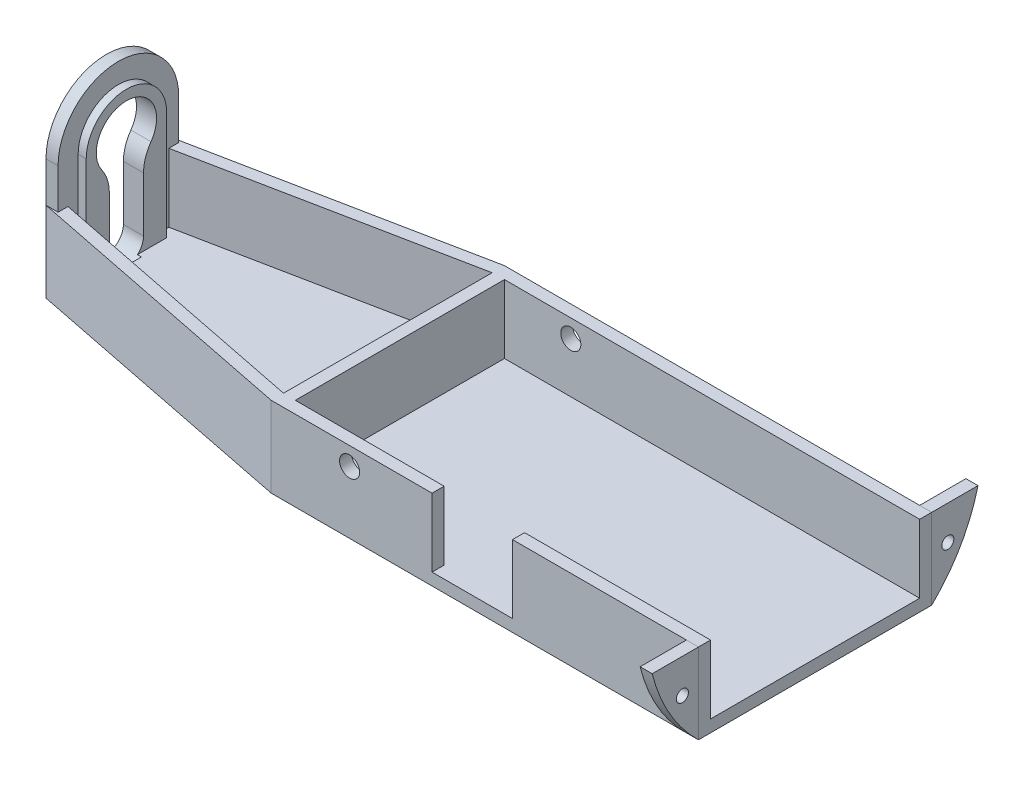
from build123d import *

# Parameters (mm, degrees)
SKETCH2_W               = 106.25
SKETCH2_H               = 58
BOSS_EXTRUDE1_DEPTH     = 3
SKETCH3_W               = 103.25
SKETCH3_H               = 3
BOSS_EXTRUDE2_DEPTH     = 20
SKETCH4_W               = 3
SKETCH4_H               = 30
BOSS_EXTRUDE3_DEPTH     = 30
BOSS_EXTRUDE4_DEPTH     = 17
SKETCH6_R               = 15
BOSS_EXTRUDE5_DEPTH     = 3
SKETCH19_R              = 1.5
BOSS_EXTRUDE9_DEPTH     = 2
CUT_EXTRUDE3_DEPTH      = 141.034147621
CUT_EXTRUDE3_DEPTH_BACK = 141.034147621
SKETCH10_R              = 2.5
SKETCH16_R              = 1.5
BOSS_EXTRUDE8_DEPTH     = 3
BOSS_EXTRUDE8_2_DEPTH   = 3
SKETCH18_W              = 20
SKETCH18_H              = 17
CUT_EXTRUDE5_DEPTH      = 3
SKETCH20_R              = 7.5
CUT_EXTRUDE6_DEPTH      = 6
FILLET1_R               = 10


with BuildPart() as part:
    # Sketch2 → Boss-Extrude1 (new body)
    with BuildSketch(Plane(origin=(0, 0, 0), x_dir=(1, 0, 0), z_dir=(0, 1, 0))):
        Polygon((-119.25, 15), (-49.25, 29), (-49.25, -29), (-119.25, -15), align=None)
        with Locations((3.875, 0)):
            Rectangle(SKETCH2_W, SKETCH2_H)
    extrude(amount=BOSS_EXTRUDE1_DEPTH)

    # Sketch3 → Boss-Extrude2 (add)
    with BuildSketch(Plane.XZ):
        with Locations((5.375, 27.5)):
            Rectangle(SKETCH3_W, SKETCH3_H)
        Polygon((-46.25, 29), (-49.25, 29), (-49.25, 25.940588292), (-49.25, -25.940588292), (-49.25, -29), (-46.25, -29), (-46.25, -26), (-46.25, 26), align=None)
        with Locations((5.375, -27.5)):
            Rectangle(SKETCH3_W, SKETCH3_H)
    extrude(amount=-BOSS_EXTRUDE2_DEPTH)

    # Sketch4 → Boss-Extrude3 (add)
    with BuildSketch(Plane.XZ):
        with Locations((-117.75, 0)):
            Rectangle(SKETCH4_W, SKETCH4_H)
    extrude(amount=-BOSS_EXTRUDE3_DEPTH)

    # Sketch5 → Boss-Extrude4 (add)
    with BuildSketch(Plane(origin=(0, 3, 0), x_dir=(1, 0, 0), z_dir=(0, 1, 0))):
        Polygon((-49.25, 25.940588292), (-116.25, 12.540588292), (-119.25, 15), (-49.25, 29), align=None)
        Polygon((-49.25, -25.940588292), (-116.25, -12.540588292), (-119.25, -15), (-49.25, -29), align=None)
    extrude(amount=BOSS_EXTRUDE4_DEPTH)

    # Sketch6 → Boss-Extrude5 (add)
    with BuildSketch(Plane.ZY.offset(119.25)):
        with Locations((0, 30)):
            Circle(SKETCH6_R)
    extrude(amount=-BOSS_EXTRUDE5_DEPTH)

    # Sketch19 → Boss-Extrude9 (add)
    with BuildSketch(Plane(origin=(-116.25, 0, 0), x_dir=(0, 0, -1), z_dir=(1, 0, 0))):
        with BuildLine():
            Line((-9.999999939, 30), (-9.999999939, 0))
            Line((-9.999999939, 0), (9.999999939, 0))
            Line((9.999999939, 0), (9.999999939, 30))
            ThreePointArc((9.999999939, 30), (0, 39.999999939), (-9.999999939, 30))
        make_face()
        with Locations((0, 30)):
            Circle(SKETCH19_R, mode=Mode.SUBTRACT)
    extrude(amount=BOSS_EXTRUDE9_DEPTH)

    # Sketch10 → Cut-Extrude3 (cut, two sides: drawn at the far end of the back side and taken through both)
    with BuildSketch(Plane.XY.offset(29).offset(-CUT_EXTRUDE3_DEPTH_BACK)):
        with Locations((-29.75, 15.5)):
            Circle(SKETCH10_R)
    extrude(amount=CUT_EXTRUDE3_DEPTH + CUT_EXTRUDE3_DEPTH_BACK, mode=Mode.SUBTRACT)

    # Sketch18 → Cut-Extrude5 (cut)
    with BuildSketch(Plane.XY.offset(29)):
        with Locations((0.75, 11.5)):
            Rectangle(SKETCH18_W, SKETCH18_H)
    extrude(amount=-CUT_EXTRUDE5_DEPTH, mode=Mode.SUBTRACT)

    # Sketch20 → Cut-Extrude6 (cut)
    with BuildSketch(Plane.ZY.offset(119.25)):
        with Locations((0, 30)):
            Circle(SKETCH20_R)
        with BuildLine():
            Line((-4.25, 30), (-4.25, 6.25))
            ThreePointArc((-4.25, 6.25), (0, 2), (4.25, 6.25))
            Line((4.25, 6.25), (4.25, 30))
            ThreePointArc((4.25, 30), (0, 34.25), (-4.25, 30))
        make_face()
    extrude(amount=-CUT_EXTRUDE6_DEPTH, mode=Mode.SUBTRACT)

    # Fillet1
    fillet1_edges = [part.edges().sort_by_distance(p)[0] for p in [
        (-116.75, 23.820396453, -4.25),
        (-116.75, 23.820396453, 4.25),
    ]]
    fillet(fillet1_edges, radius=FILLET1_R)


with BuildPart() as body_2:
    # Sketch16 → Boss-Extrude8 (new body)
    with BuildSketch(Plane(origin=(57, 0, 0), x_dir=(0, 0, -1), z_dir=(1, 0, 0))):
        with BuildLine():
            Line((-29, 20), (-40.509258201, 20))
            ThreePointArc((-40.509258201, 20), (-36.164682273, 9.188566698), (-29, 0))
            Line((-29, 0), (-29, 20))
        make_face()
        with Locations((-33, 11.5)):
            Circle(SKETCH16_R, mode=Mode.SUBTRACT)
    extrude(amount=-BOSS_EXTRUDE8_DEPTH)


with BuildPart() as body_3:
    # Sketch16 → Boss-Extrude8 2 (new body)
    with BuildSketch(Plane(origin=(57, 0, 0), x_dir=(0, 0, -1), z_dir=(1, 0, 0))):
        with BuildLine():
            Line((29, 20), (40.509258201, 20))
            ThreePointArc((40.509258201, 20), (36.164682273, 9.188566698), (29, 0))
            Line((29, 0), (29, 20))
        make_face()
        with Locations((33, 11.5)):
            Circle(SKETCH16_R, mode=Mode.SUBTRACT)
    extrude(amount=-BOSS_EXTRUDE8_2_DEPTH)


solid = Compound([part.part, body_2.part, body_3.part])
